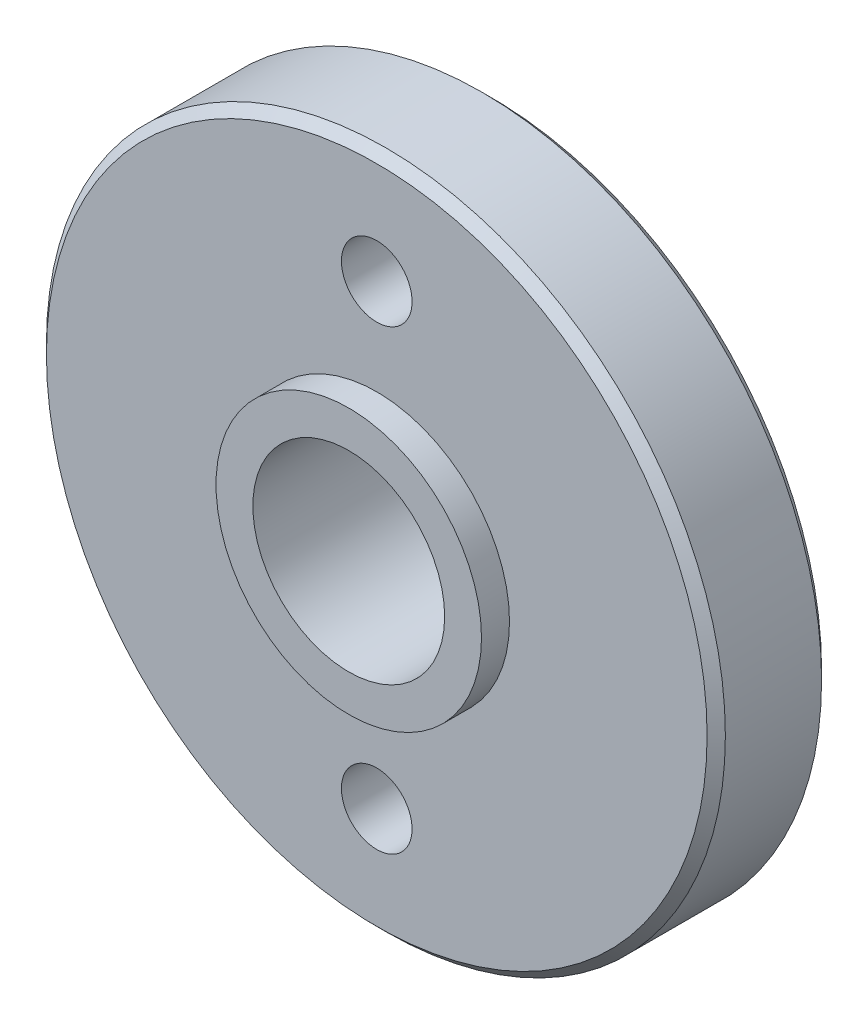
from build123d import *

# Parameters (mm, degrees)
CHAMFER1_SIZE               = 0.381
F_32_0_116_DIAMETER_HOLE1_D = 2.9464
CHAMFER2_SIZE               = 2.032


with BuildPart() as part:
    # Sketch1 → Revolve1 (revolve)
    with BuildSketch(Plane(origin=(0, 0, 0), x_dir=(0, 0, -1), z_dir=(1, 0, 0)), mode=Mode.PRIVATE) as revolve1_sk:
        Polygon((0, 14.1605), (4.7752, 14.1605), (4.7752, 5.5626), (11.684, 5.5626), (11.684, 0), (10.760342906, 0), (8.3566, 4.0005), (-1.1684, 4.0005), (-1.1684, 5.5372), (0, 5.5372), align=None)
    revolve(revolve1_sk.sketch.rotate(Axis((0, 0, -14.800465311), (0, 0, -1)), 90), axis=Axis((0, 0, -14.800465311), (0, 0, -1)))

    # Chamfer1
    chamfer1_edges = [part.edges().sort_by_distance(p)[0] for p in [
        (-14.1605, 0, -4.7752),
        (-14.1605, 0, 0),
    ]]
    chamfer(chamfer1_edges, length=CHAMFER1_SIZE)

    # #32 (0.116) Diameter Hole1 (through all)
    with Locations(Plane(origin=(0, 0, -4.7752), x_dir=(-1, 0, 0), z_dir=(0, 0, -1))):
        with Locations((0, 9.525), (0, -9.525)):
            Hole(F_32_0_116_DIAMETER_HOLE1_D / 2)

    # Chamfer2
    chamfer2_edges = [part.edges().sort_by_distance(p)[0] for p in [
        (-5.5626, 0, -11.684),
    ]]
    chamfer(chamfer2_edges, length=CHAMFER2_SIZE)


solid = part.part
